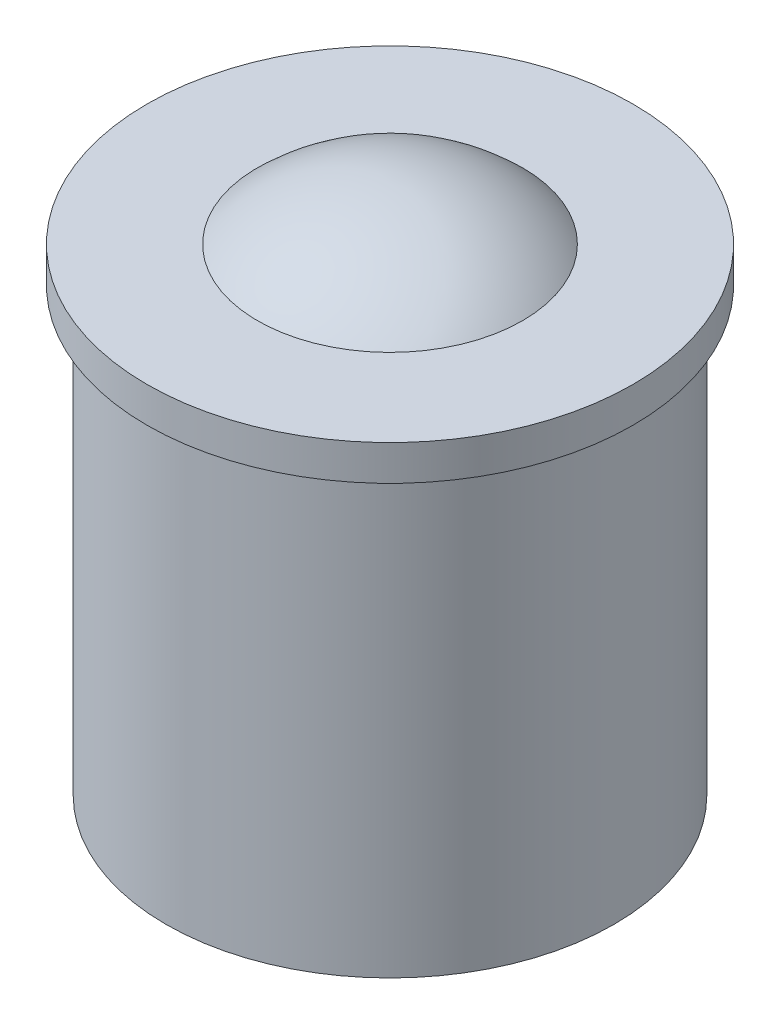
from build123d import *


with BuildPart() as part:
    # Sketch1 → Revolve1 (revolve)
    with BuildSketch(Plane.XY, mode=Mode.PRIVATE) as revolve1_sk:
        with BuildLine():
            Line((0, 0), (4.0259, 0))
            Line((4.0259, 0), (4.0259, 7.9375))
            Line((4.0259, 7.9375), (4.365625, 7.9375))
            Line((4.365625, 7.9375), (4.365625, 8.5725))
            Line((4.365625, 8.5725), (2.38125, 8.5725))
            ThreePointArc((2.38125, 8.5725), (1.28234237, 9.278043424), (0, 9.525))
            Line((0, 9.525), (0, 0))
        make_face()
    revolve(revolve1_sk.sketch.rotate(Axis((0, -5.815188889, 0), (0, 1, 0)), 90), axis=Axis((0, -5.815188889, 0), (0, 1, 0)))


solid = part.part
